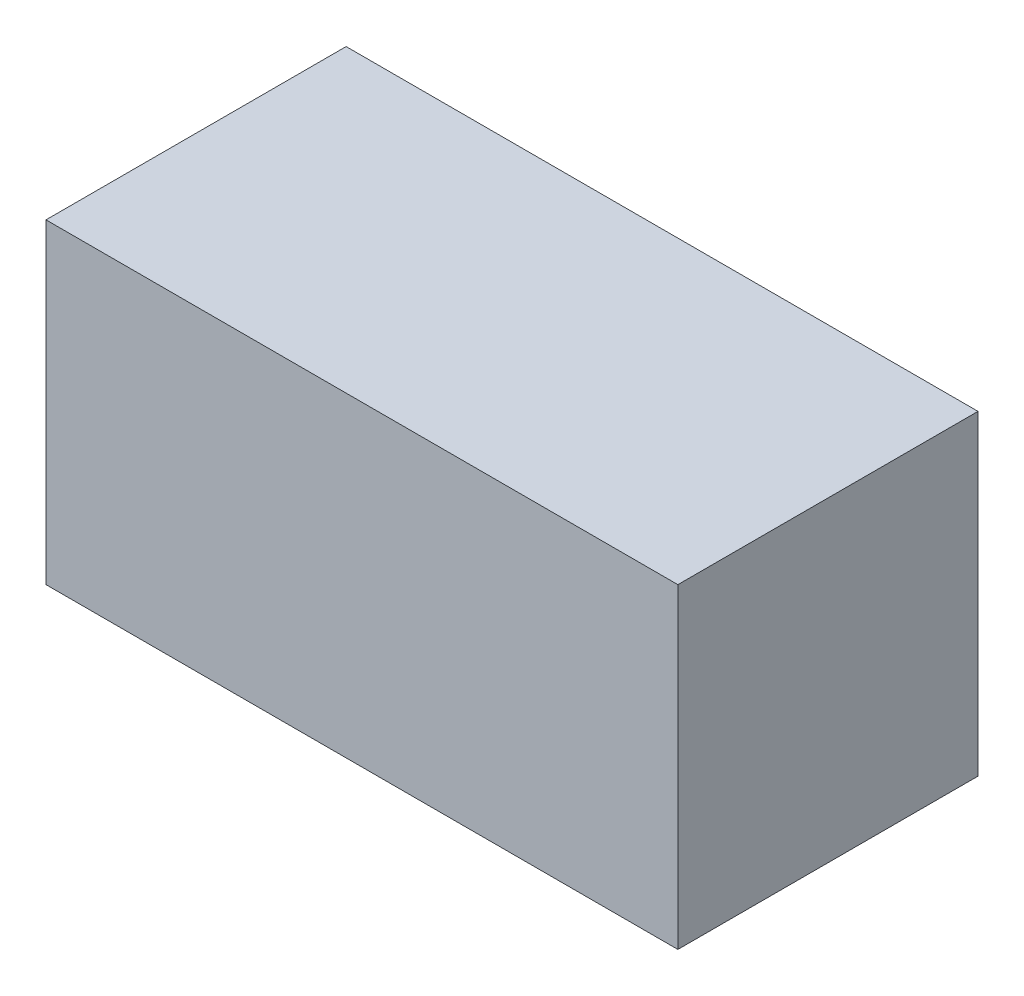
from build123d import *

# Parameters (mm, degrees)
SKETCH1_W           = 40
SKETCH1_H           = 20
BOSS_EXTRUDE1_DEPTH = 19


with BuildPart() as part:
    # Sketch1 → Boss-Extrude1 (new body)
    with BuildSketch(Plane.XY):
        with Locations((20, 10)):
            Rectangle(SKETCH1_W, SKETCH1_H)
    extrude(amount=-BOSS_EXTRUDE1_DEPTH)


solid = part.part
